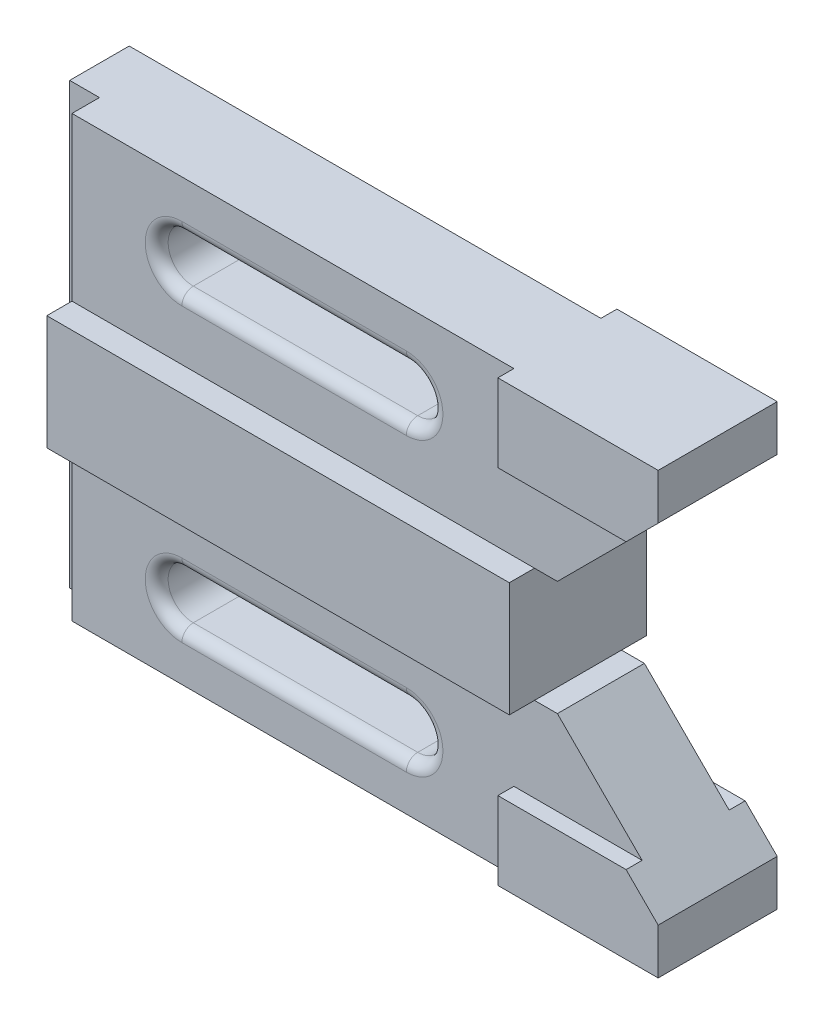
from build123d import *

# Parameters (mm, degrees)
EXTRUDE_1_DEPTH      = 9.5
EXTRUDE_2_DEPTH      = 3.5
EXTRUDE_2_DEPTH_BACK = 22.5
EXTRUDE_3_DEPTH      = 5.5
EXTRUDE_3_DEPTH_BACK = 24.5
SKETCH_8_W           = 107.5
SKETCH_8_H           = 25
SKETCH_9_W           = 6.5
SKETCH_9_H           = 96
CUT_EXTRUDE_1_DEPTH  = 11.5
CUT_EXTRUDE_2_DEPTH  = 52.5
FILLET_1_R           = 2.5


with BuildPart() as part:
    # 草图1 → 凸台-拉伸1 (new, symmetric)
    with BuildSketch(Plane.XY):
        Polygon((-107.5, 48), (30.5, 48), (30.5, 38), (5, 12.5), (0, 12.5), (0, -12.5), (5, -12.5), (30.5, -38), (30.5, -48), (-107.5, -48), align=None)
    extrude(amount=EXTRUDE_1_DEPTH, both=True)

    # 草图2 → 凸台-拉伸2 (add, two sides: drawn at the far end of the back side and taken through both)
    with BuildSketch(Plane.XY.offset(9.5).offset(-EXTRUDE_2_DEPTH_BACK)):
        Polygon((-4.5, 31), (23.5, 31), (30.5, 38), (30.5, 48), (-4.5, 48), align=None)
        Polygon((30.5, -38), (23.5, -31), (-4.5, -31), (-4.5, -48), (30.5, -48), align=None)
    extrude(amount=EXTRUDE_2_DEPTH + EXTRUDE_2_DEPTH_BACK)

    # 草图8 → 凸台-拉伸3 (add, two sides: drawn at the far end of the back side and taken through both)
    with BuildSketch(Plane(origin=(0, 0, -9.5), x_dir=(-1, 0, 0), z_dir=(0, 0, -1)).offset(-EXTRUDE_3_DEPTH_BACK)):
        with Locations((53.75, 0)):
            Rectangle(SKETCH_8_W, SKETCH_8_H)
    extrude(amount=EXTRUDE_3_DEPTH + EXTRUDE_3_DEPTH_BACK)

    # 草图9 → 切除-拉伸1 (cut)
    with BuildSketch(Plane.XY.offset(15)):
        with Locations((-104.25, 0)):
            Rectangle(SKETCH_9_W, SKETCH_9_H)
    extrude(amount=-CUT_EXTRUDE_1_DEPTH, mode=Mode.SUBTRACT)

    # 草图11 → 切除-拉伸2 (cut)
    with BuildSketch(Plane(origin=(0, 0, -9.5), x_dir=(-1, 0, 0), z_dir=(0, 0, -1))):
        with BuildLine():
            Line((28, 37.09009956), (77, 37.09009956))
            ThreePointArc((77, 37.09009956), (82.5, 31.59009956), (77, 26.09009956))
            Line((77, 26.09009956), (28, 26.09009956))
            ThreePointArc((28, 26.09009956), (22.5, 31.59009956), (28, 37.09009956))
        make_face()
        with BuildLine():
            Line((28, -26.570922994), (77, -26.570922994))
            ThreePointArc((77, -26.570922994), (82.5, -32.070922994), (77, -37.570922994))
            Line((77, -37.570922994), (28, -37.570922994))
            ThreePointArc((28, -37.570922994), (22.5, -32.070922994), (28, -26.570922994))
        make_face()
    extrude(amount=-CUT_EXTRUDE_2_DEPTH, mode=Mode.SUBTRACT)

    # 圆角1
    fillet_1_edges = [part.edges().sort_by_distance(p)[0] for p in [
        (-22.5, 31.59009956, 9.5),
        (-52.5, 37.09009956, 9.5),
        (-82.5, 31.59009956, 9.5),
        (-52.5, 26.09009956, 9.5),
        (-22.5, 31.59009956, -9.5),
        (-52.5, 26.09009956, -9.5),
        (-82.5, 31.59009956, -9.5),
        (-52.5, 37.09009956, -9.5),
        (-22.5, -32.070922994, 9.5),
        (-52.5, -26.570922994, 9.5),
        (-82.5, -32.070922994, 9.5),
        (-52.5, -37.570922994, 9.5),
        (-22.5, -32.070922994, -9.5),
        (-52.5, -37.570922994, -9.5),
        (-82.5, -32.070922994, -9.5),
        (-52.5, -26.570922994, -9.5),
    ]]
    fillet(fillet_1_edges, radius=FILLET_1_R)


solid = part.part
